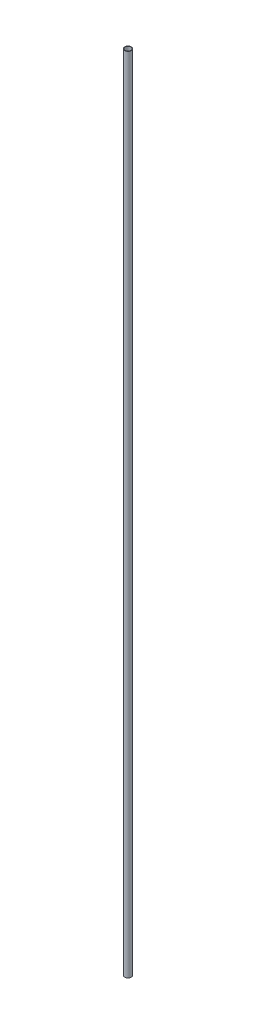
from build123d import *

# Parameters (mm, degrees)
SKETCH1_R           = 4
SKETCH1_R_2         = 3.5
BOSS_EXTRUDE1_DEPTH = 970


with BuildPart() as part:
    # Sketch1 → Boss-Extrude1 (new body)
    with BuildSketch(Plane(origin=(0, 0, 0), x_dir=(1, 0, 0), z_dir=(0, 1, 0))):
        with Locations(Location((0, 0, 0), (0, 0, 270))):
            Circle(SKETCH1_R)
        with Locations(Location((0, 0, 0), (0, 0, 270))):
            Circle(SKETCH1_R_2, mode=Mode.SUBTRACT)
    extrude(amount=BOSS_EXTRUDE1_DEPTH)


solid = part.part
